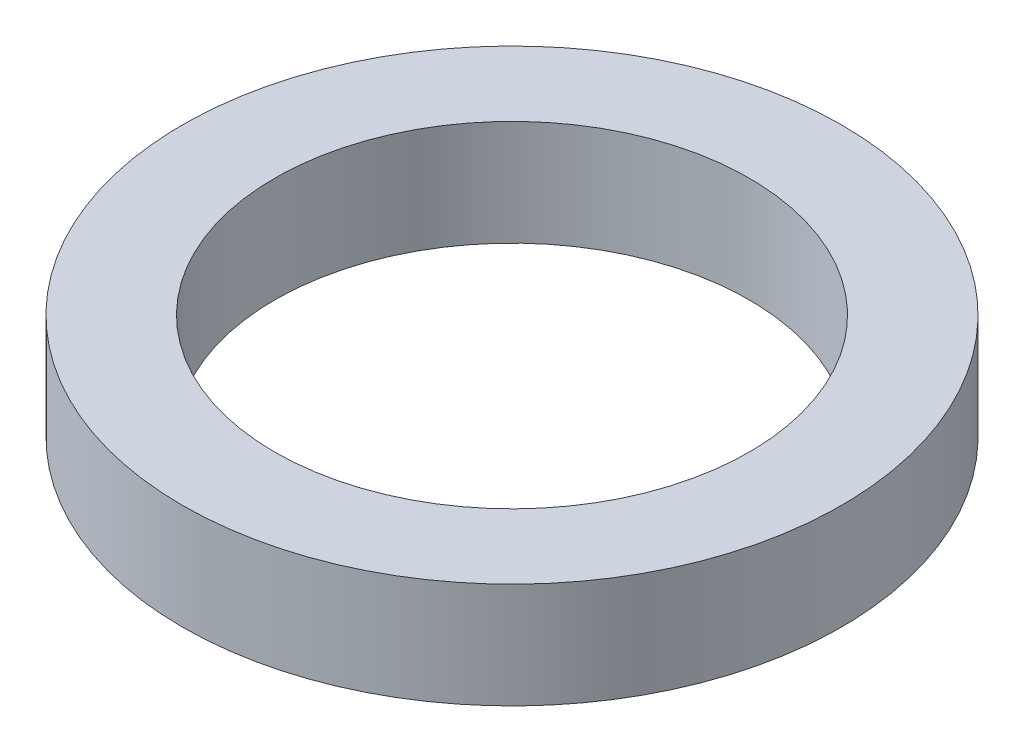
from build123d import *

# Parameters (mm, degrees)
SKETCH_1_R      = 62.5
SKETCH_1_R_2    = 45
EXTRUDE_1_DEPTH = 20


with BuildPart() as part:
    # 草图1 → 凸台-拉伸1 (new body)
    with BuildSketch(Plane(origin=(0, 0, 0), x_dir=(1, 0, 0), z_dir=(0, 1, 0))):
        with Locations(Location((0, 0, 0), (0, 0, 270))):
            Circle(SKETCH_1_R)
        with Locations(Location((0, 0, 0), (0, 0, 270))):
            Circle(SKETCH_1_R_2, mode=Mode.SUBTRACT)
    extrude(amount=EXTRUDE_1_DEPTH)


solid = part.part
